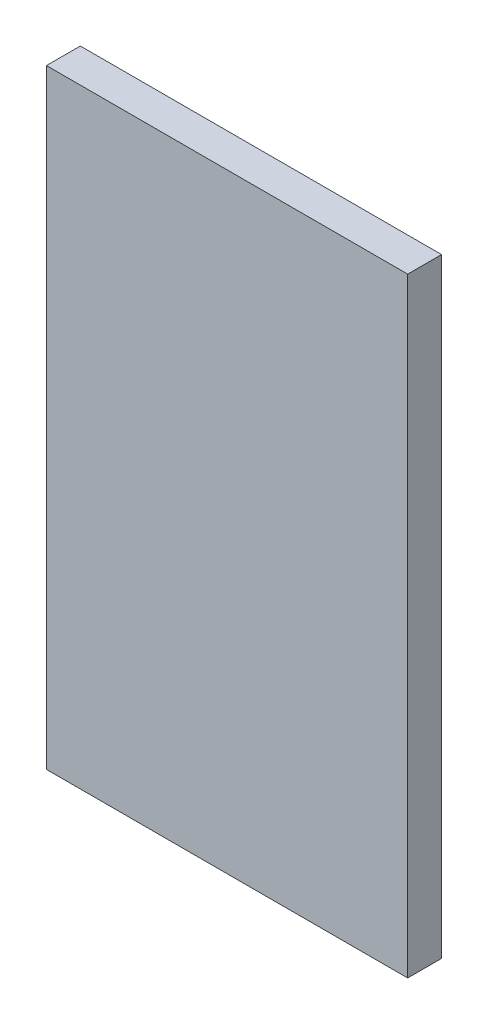
from build123d import *

# Parameters (mm, degrees)
SKETCH1_W           = 203.2
SKETCH1_H           = 342.9
BOSS_EXTRUDE1_DEPTH = 19.05


with BuildPart() as part:
    # Sketch1 → Boss-Extrude1 (new body)
    with BuildSketch(Plane.XY):
        Rectangle(SKETCH1_W, SKETCH1_H)
    extrude(amount=BOSS_EXTRUDE1_DEPTH)


solid = part.part
